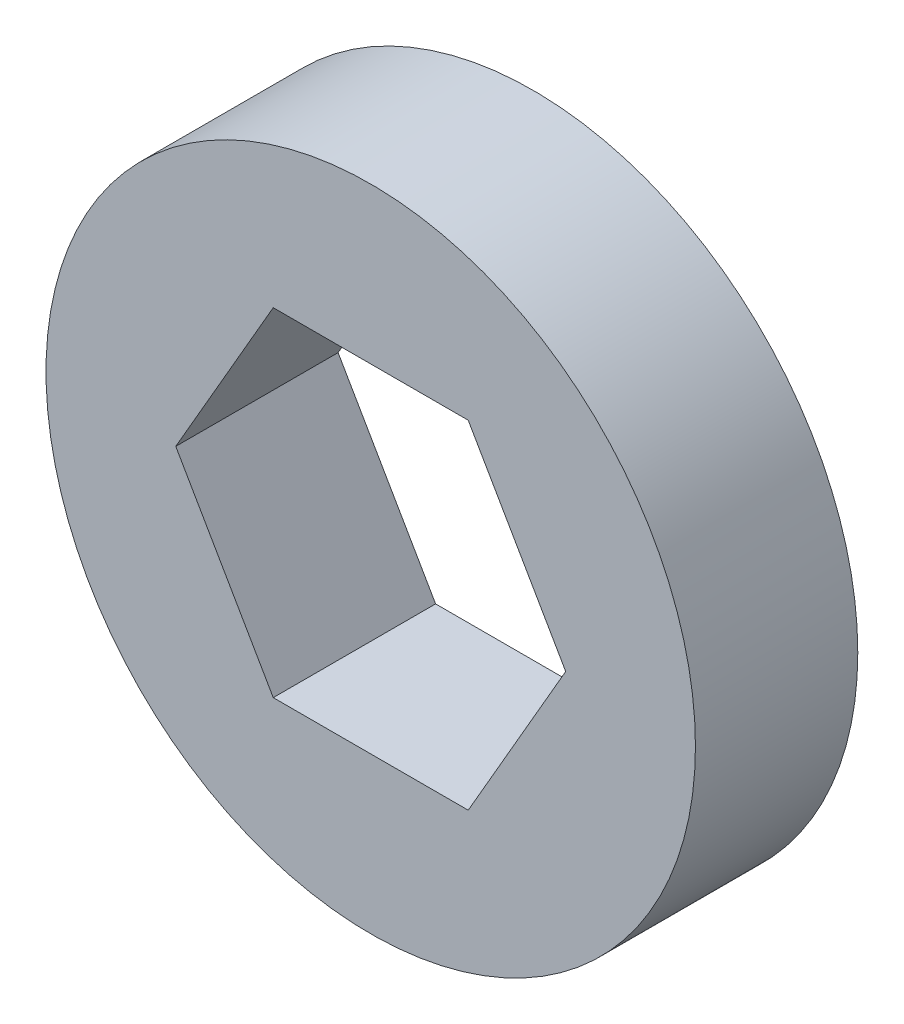
from build123d import *

# Parameters (mm, degrees)
SKETCH1_R           = 12.7
BOSS_EXTRUDE1_DEPTH = 6.35


with BuildPart() as part:
    # Sketch1 → Boss-Extrude1 (new body)
    with BuildSketch(Plane.XY):
        Circle(SKETCH1_R)
        Polygon((3.812821178, -6.604), (7.625642355, 0), (3.812821178, 6.604), (-3.812821178, 6.604), (-7.625642355, 0), (-3.812821178, -6.604), align=None, mode=Mode.SUBTRACT)
    extrude(amount=BOSS_EXTRUDE1_DEPTH)


solid = part.part
